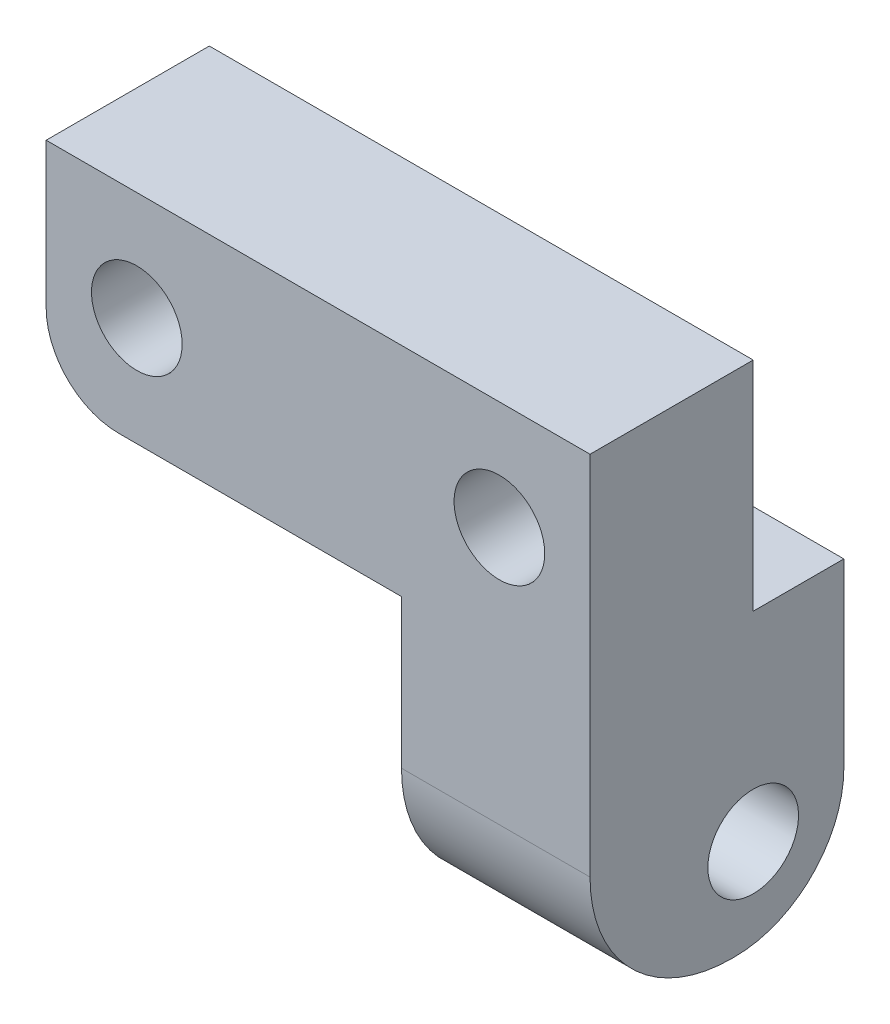
from build123d import *

# Parameters (mm, degrees)
SKETCH_1_W         = 15
SKETCH_1_H         = 6
EXTRUDE_1_DEPTH    = 4.5
HOLE_WIZARD_M3_1_D = 2.5
EXTRUDE_START      = 2.3
SKETCH_5_W         = 7
SKETCH_5_H         = 8
EXTRUDE_2_DEPTH    = 5.2
FILLET_1_R         = 3.9
FILLET_2_R         = 3
HOLE_WIZARD_M3_2_D = 2.5
FILLET_3_R         = 2


with BuildPart() as part:
    # 草图1 → 凸台-拉伸1 (new body)
    with BuildSketch(Plane.XY):
        Rectangle(SKETCH_1_W, SKETCH_1_H)
    extrude(amount=EXTRUDE_1_DEPTH)

    # M3 螺纹孔1 (through all)
    with Locations(Plane.XY.offset(4.5)):
        with Locations((-5, 0), (5, 0)):
            Hole(HOLE_WIZARD_M3_1_D / 2)

    # 草图5 → 凸台-拉伸2 (add)
    with BuildSketch(Plane(origin=(0, 0, 0), x_dir=(0, 0, -1), z_dir=(1, 0, 0)).offset(EXTRUDE_START)):
        with Locations((-1, -7)):
            Rectangle(SKETCH_5_W, SKETCH_5_H)
    extrude(amount=EXTRUDE_2_DEPTH)

    # 圆角1
    fillet_1_edges = [part.edges().sort_by_distance(p)[0] for p in [
        (4.9, -11, 4.5),
    ]]
    fillet(fillet_1_edges, radius=FILLET_1_R)

    # 圆角2
    fillet_2_edges = [part.edges().sort_by_distance(p)[0] for p in [
        (4.9, -11, -2.5),
    ]]
    fillet(fillet_2_edges, radius=FILLET_2_R)

    # M3 螺纹孔2 (through all)
    with Locations(Plane.ZY.offset(-2.3)):
        with Locations((0, -8.5)):
            Hole(HOLE_WIZARD_M3_2_D / 2)

    # 圆角3
    fillet_3_edges = [part.edges().sort_by_distance(p)[0] for p in [
        (-7.5, -3, 2.25),
    ]]
    fillet(fillet_3_edges, radius=FILLET_3_R)


solid = part.part
